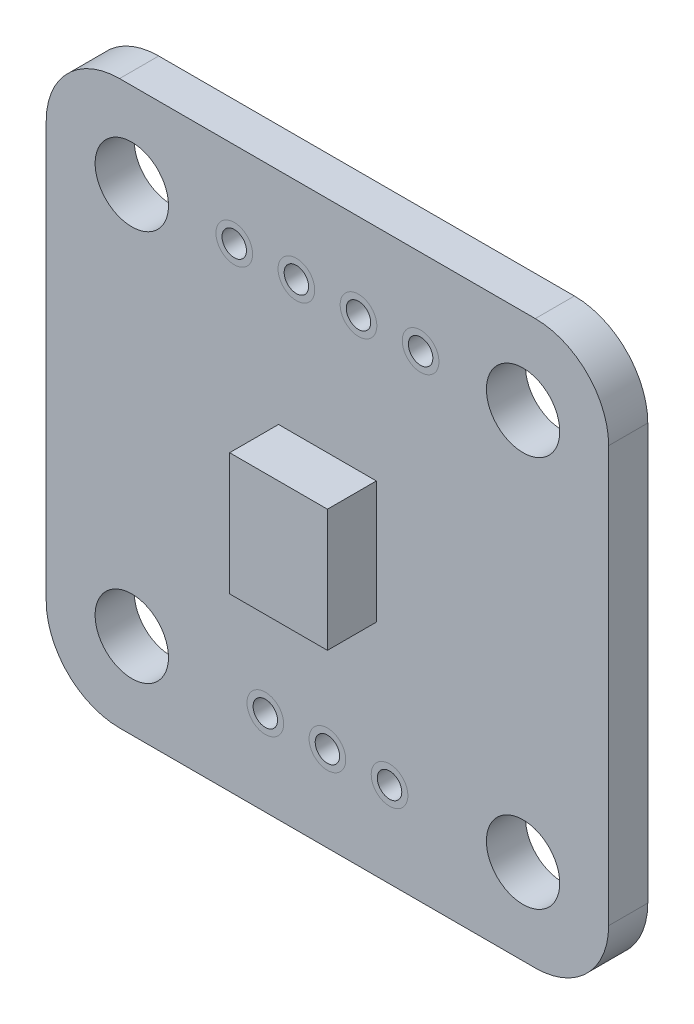
from build123d import *

# Parameters (mm, degrees)
SKETCH1_R           = 1.5
SKETCH1_R_2         = 0.5
BOSS_EXTRUDE1_DEPTH = 0.8
SKETCH2_W           = 4
SKETCH2_H           = 5
BOSS_EXTRUDE2_DEPTH = 2


with BuildPart() as part:
    # Sketch1 → Boss-Extrude1 (new, symmetric)
    with BuildSketch(Plane.XY):
        with BuildLine():
            Line((-8.5, -11.5), (8.5, -11.5))
            ThreePointArc((8.5, -11.5), (10.621320344, -10.621320344), (11.5, -8.5))
            Line((11.5, -8.5), (11.5, 8.5))
            ThreePointArc((11.5, 8.5), (10.621320344, 10.621320344), (8.5, 11.5))
            Line((8.5, 11.5), (-8.5, 11.5))
            ThreePointArc((-8.5, 11.5), (-10.621320344, 10.621320344), (-11.5, 8.5))
            Line((-11.5, 8.5), (-11.5, -8.5))
            ThreePointArc((-11.5, -8.5), (-10.621320344, -10.621320344), (-8.5, -11.5))
        make_face()
        with Locations((-8, 8)):
            Circle(SKETCH1_R, mode=Mode.SUBTRACT)
        with Locations((8, 8)):
            Circle(SKETCH1_R, mode=Mode.SUBTRACT)
        with Locations((8, -8)):
            Circle(SKETCH1_R, mode=Mode.SUBTRACT)
        with Locations((-8, -8)):
            Circle(SKETCH1_R, mode=Mode.SUBTRACT)
        with Locations((0, -8)):
            Circle(SKETCH1_R_2, mode=Mode.SUBTRACT)
        with Locations((-2.54, -8)):
            Circle(SKETCH1_R_2, mode=Mode.SUBTRACT)
        with Locations((2.54, -8)):
            Circle(SKETCH1_R_2, mode=Mode.SUBTRACT)
        with Locations((-1.27, 8)):
            Circle(SKETCH1_R_2, mode=Mode.SUBTRACT)
        with Locations((1.27, 8)):
            Circle(SKETCH1_R_2, mode=Mode.SUBTRACT)
        with Locations((-3.81, 8)):
            Circle(SKETCH1_R_2, mode=Mode.SUBTRACT)
        with Locations((3.81, 8)):
            Circle(SKETCH1_R_2, mode=Mode.SUBTRACT)
    extrude(amount=BOSS_EXTRUDE1_DEPTH, both=True)

    # Sketch2 → Boss-Extrude2 (add)
    with BuildSketch(Plane.XY.offset(0.8)):
        Rectangle(SKETCH2_W, SKETCH2_H)
    extrude(amount=BOSS_EXTRUDE2_DEPTH)


solid = part.part
